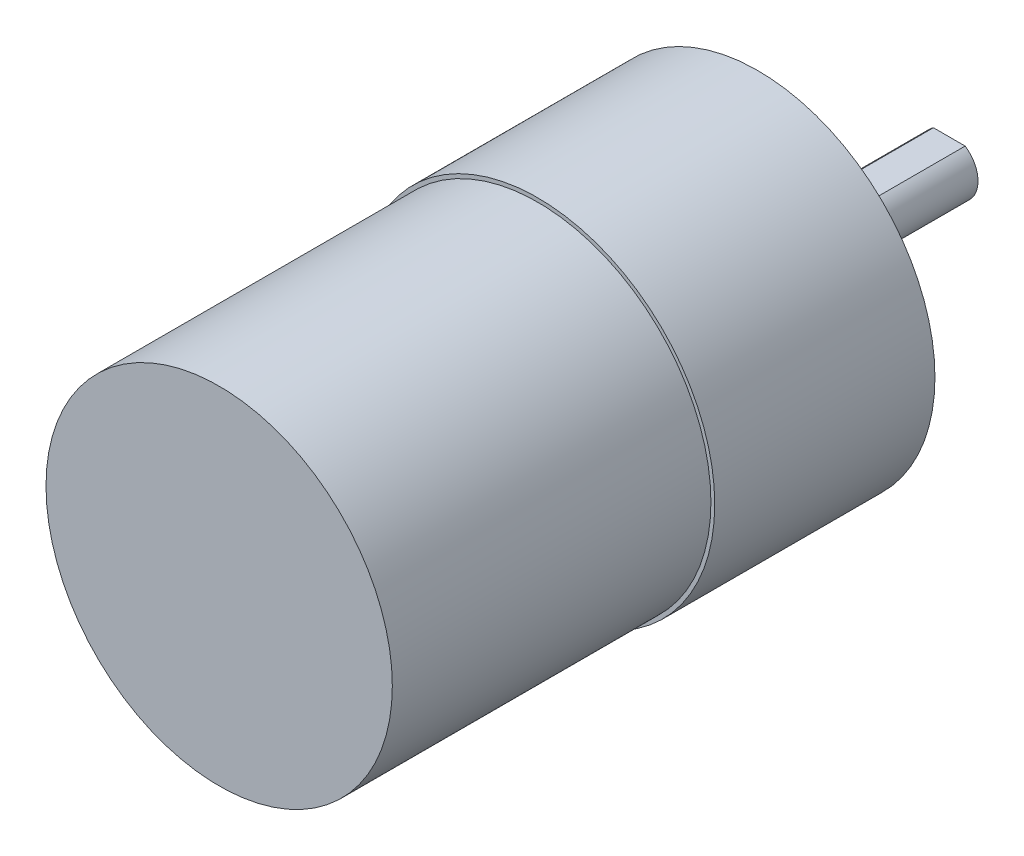
from build123d import *

# Parameters (mm, degrees)
SKETCH1_R           = 18.5
BOSS_EXTRUDE1_DEPTH = 23.016176471
SKETCH2_R           = 18.1
BOSS_EXTRUDE2_DEPTH = 33.3
SKETCH3_R           = 6
BOSS_EXTRUDE3_DEPTH = 5
BOSS_EXTRUDE4_DEPTH = 15
CUT_EXTRUDE1_START  = -14
CUT_EXTRUDE1_DEPTH  = 14
SKETCH6_R           = 1.5
CUT_EXTRUDE2_DEPTH  = 8


with BuildPart() as part:
    # Sketch1 → Boss-Extrude1 (new body)
    with BuildSketch(Plane.XY):
        Circle(SKETCH1_R)
    extrude(amount=BOSS_EXTRUDE1_DEPTH)

    # Sketch2 → Boss-Extrude2 (add)
    with BuildSketch(Plane.XY.offset(23.016176471)):
        Circle(SKETCH2_R)
    extrude(amount=BOSS_EXTRUDE2_DEPTH)

    # Sketch3 → Boss-Extrude3 (add)
    with BuildSketch(Plane(origin=(0, 0, 0), x_dir=(-1, 0, 0), z_dir=(0, 0, -1))):
        Circle(SKETCH3_R)
    extrude(amount=BOSS_EXTRUDE3_DEPTH)

    # Sketch4 → Boss-Extrude4 (add)
    with BuildSketch(Plane(origin=(0, 0, -5), x_dir=(-1, 0, 0), z_dir=(0, 0, -1))):
        with BuildLine():
            ThreePointArc((-0.515876955, 2.95531233), (0, -3), (0.515876955, 2.95531233))
            ThreePointArc((0.515876955, 2.95531233), (0, 3), (-0.515876955, 2.95531233))
        make_face()
    extrude(amount=BOSS_EXTRUDE4_DEPTH)

    # Sketch5 → Cut-Extrude1 (cut)
    with BuildSketch(Plane(origin=(0, 0, -20), x_dir=(-1, 0, 0), z_dir=(0, 0, -1)).offset(CUT_EXTRUDE1_START)):
        with BuildLine():
            Line((-1.658312395, 2.5), (1.658312395, 2.5))
            ThreePointArc((1.658312395, 2.5), (0, 3), (-1.658312395, 2.5))
        make_face()
    extrude(amount=CUT_EXTRUDE1_DEPTH, mode=Mode.SUBTRACT)

    # Sketch6 → Cut-Extrude2 (cut)
    with BuildSketch(Plane(origin=(0, 0, 0), x_dir=(-1, 0, 0), z_dir=(0, 0, -1))):
        with Locations((7.75, 13.423393759)):
            Circle(SKETCH6_R)
        with Locations((15.5, 0)):
            Circle(SKETCH6_R)
        with Locations((7.75, -13.423393759)):
            Circle(SKETCH6_R)
        with Locations((-7.75, -13.423393759)):
            Circle(SKETCH6_R)
        with Locations((-15.5, 0)):
            Circle(SKETCH6_R)
        with Locations((-7.75, 13.423393759)):
            Circle(SKETCH6_R)
    extrude(amount=-CUT_EXTRUDE2_DEPTH, mode=Mode.SUBTRACT)


solid = part.part
